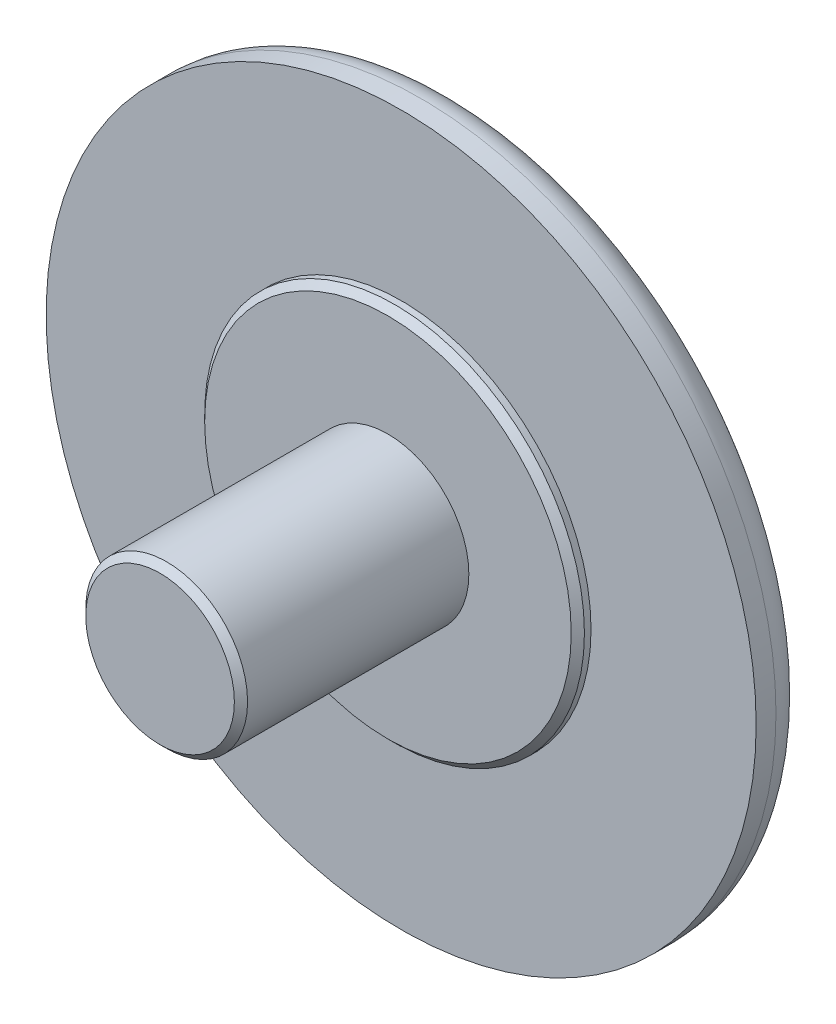
from build123d import *

# Parameters (mm, degrees)
CHAMFER1_SIZE = 0.2
CHAMFER2_SIZE = 0.2


with BuildPart() as part:
    # Sketch1 → Revolve1 (revolve)
    with BuildSketch(Plane(origin=(0, 0, 0), x_dir=(1, 0, 0), z_dir=(0, 1, 0))):
        with BuildLine():
            Line((2.45, 0), (0, 0))
            Line((0, 0), (0, 8.9))
            Line((0, 8.9), (9.75, 8.9))
            ThreePointArc((9.75, 8.9), (10.457106781, 8.607106781), (10.75, 7.9))
            Line((10.75, 7.9), (10.75, 7.3))
            Line((10.75, 7.3), (5.75, 7.3))
            Line((5.75, 7.3), (5.75, 6.9))
            Line((5.75, 6.9), (2.45, 6.9))
            Line((2.45, 6.9), (2.45, 0))
        make_face()
    revolve(axis=Axis((0, 0, 0), (0, 0, -1)))

    # Chamfer1
    chamfer1_edges = [part.edges().sort_by_distance(p)[0] for p in [
        (-5.75, 0, -6.9),
    ]]
    chamfer(chamfer1_edges, length=CHAMFER1_SIZE)

    # Chamfer2
    chamfer2_edges = [part.edges().sort_by_distance(p)[0] for p in [
        (-2.45, 0, 0),
    ]]
    chamfer(chamfer2_edges, length=CHAMFER2_SIZE)


solid = part.part
